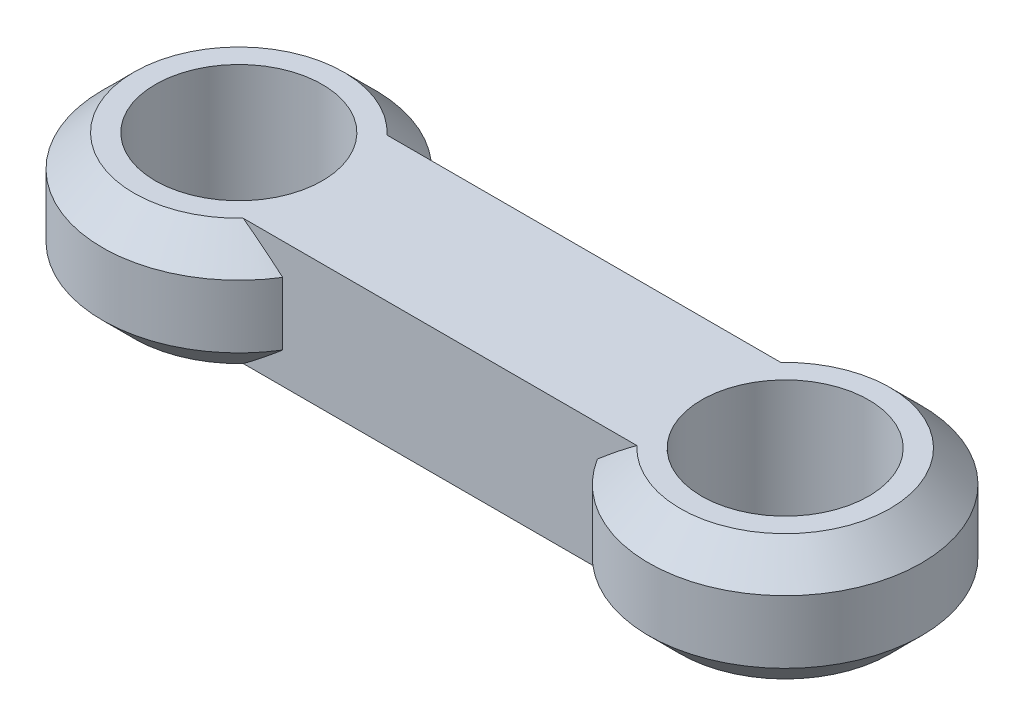
from build123d import *

# Parameters (mm, degrees)
SKETCH1_R           = 3.98
BOSS_EXTRUDE1_DEPTH = 6
CHAMFER1_SIZE       = 1.5


with BuildPart() as part:
    # Sketch1 → Boss-Extrude1 (new body)
    with BuildSketch(Plane(origin=(0, 0, 0), x_dir=(1, 0, 0), z_dir=(0, 1, 0))):
        with BuildLine():
            Line((-5.521270529, 3.430097921), (-20.521270529, 3.430097921))
            ThreePointArc((-20.521270529, 3.430097921), (-32.542541057, 0), (-20.521270529, -3.430097921))
            Line((-20.521270529, -3.430097921), (-5.521270529, -3.430097921))
            ThreePointArc((-5.521270529, -3.430097921), (6.5, 0), (-5.521270529, 3.430097921))
        make_face()
        with Locations(Location((-26.042541057, 0, 0), (0, 0, 270))):
            Circle(SKETCH1_R, mode=Mode.SUBTRACT)
        with Locations(Location((0, 0, 0), (0, 0, 270))):
            Circle(SKETCH1_R, mode=Mode.SUBTRACT)
    extrude(amount=BOSS_EXTRUDE1_DEPTH)

    # Chamfer1
    chamfer1_edges = [part.edges().sort_by_distance(p)[0] for p in [
        (-32.542541057, 0, 0),
        (-32.542541057, 6, 0),
        (6.5, 6, 0),
        (6.5, 0, 0),
    ]]
    chamfer(chamfer1_edges, length=CHAMFER1_SIZE)


solid = part.part
